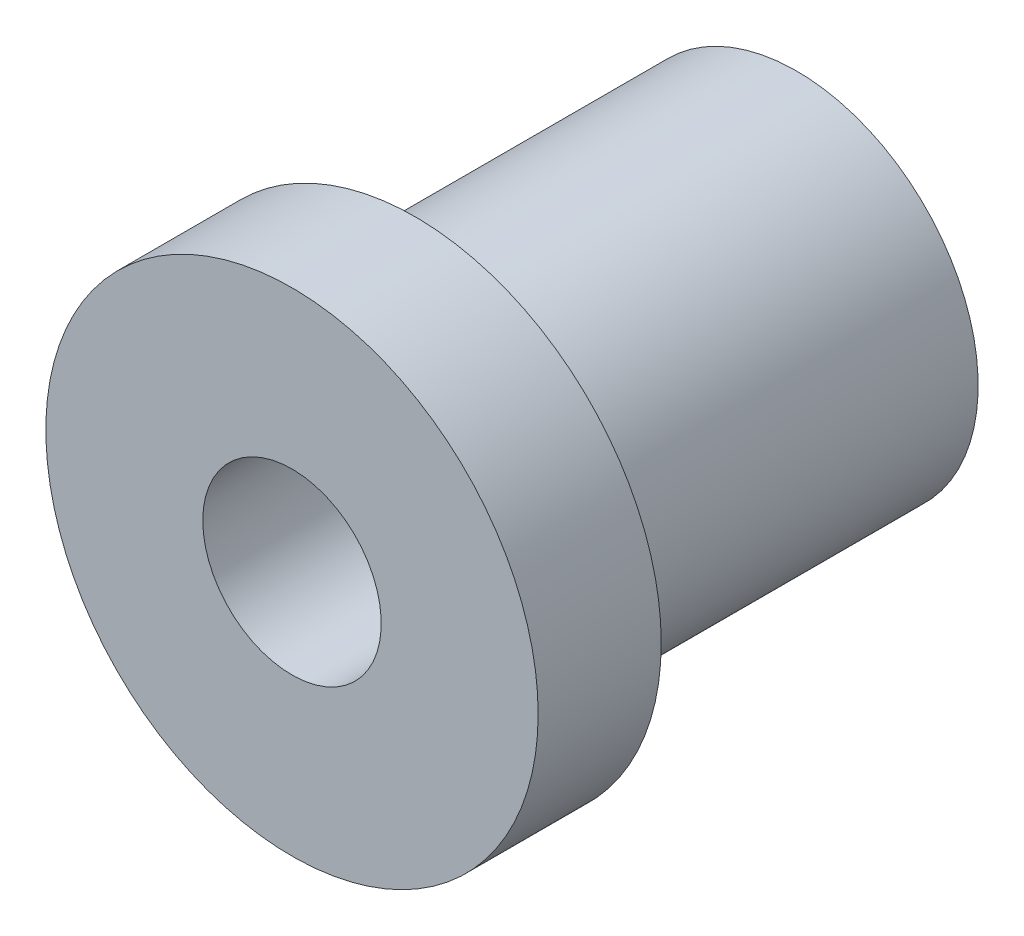
from build123d import *

# Parameters (mm, degrees)
SKETCH_1_R      = 2.95
SKETCH_1_R_2    = 1.45
EXTRUDE_1_DEPTH = 3.1
SKETCH_2_R      = 4
SKETCH_2_R_2    = 1.45
EXTRUDE_2_DEPTH = 2


with BuildPart() as part:
    # 草图1 → 凸台-拉伸1 (new, symmetric)
    with BuildSketch(Plane.XY):
        with Locations(Location((0, 0, 0), (0, 0, 180))):
            Circle(SKETCH_1_R)
        with Locations(Location((0, 0, 0), (0, 0, 180))):
            Circle(SKETCH_1_R_2, mode=Mode.SUBTRACT)
    extrude(amount=EXTRUDE_1_DEPTH, both=True)

    # 草图2 → 凸台-拉伸2 (add)
    with BuildSketch(Plane.XY.offset(3.1)):
        Circle(SKETCH_2_R)
        with Locations(Location((0, 0, 0), (0, 0, 180))):
            Circle(SKETCH_2_R_2, mode=Mode.SUBTRACT)
    extrude(amount=EXTRUDE_2_DEPTH)


solid = part.part
